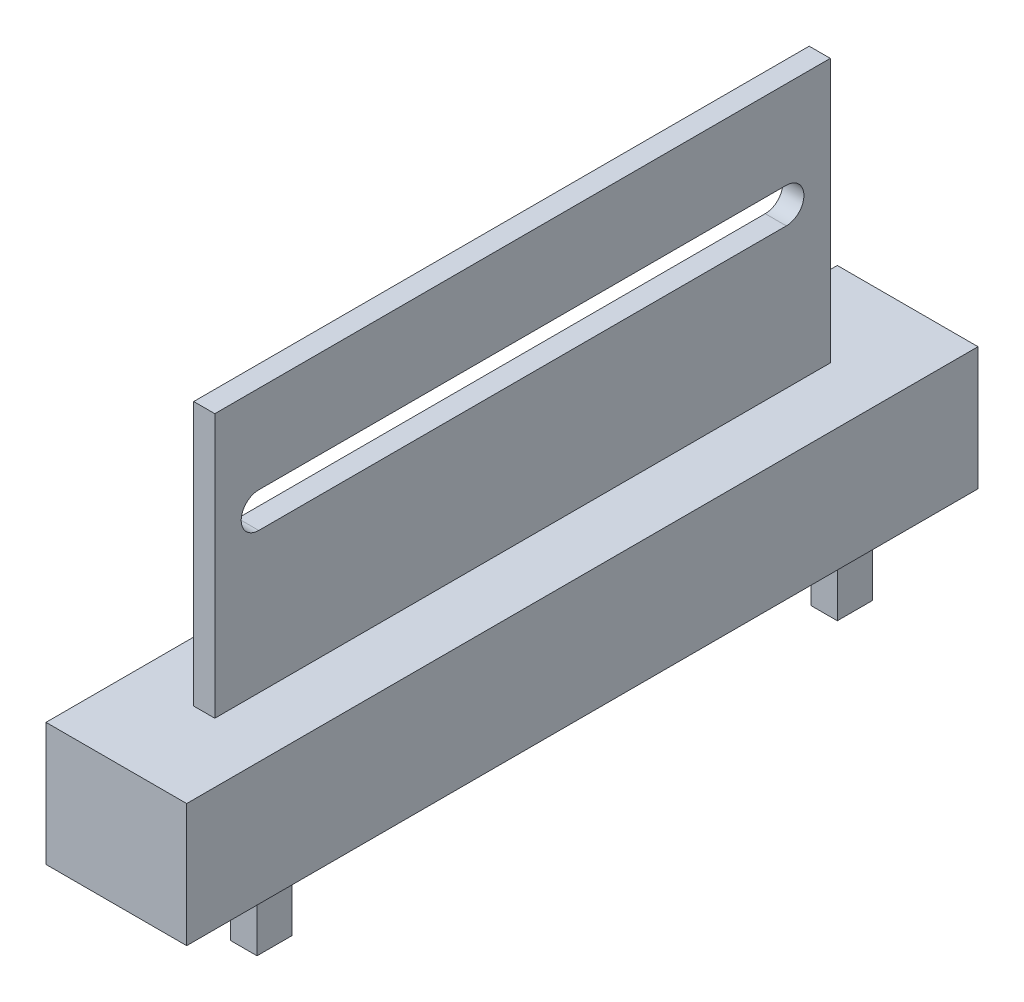
from build123d import *

# Parameters (mm, degrees)
SKETCH1_W             = 45
SKETCH1_H             = 7
BOSS_EXTRUDE1_DEPTH   = 4
SKETCH2_W             = 1.2
SKETCH2_H             = 35
BOSS_EXTRUDE2_DEPTH   = 15
SKETCH3_W             = 1.5
SKETCH3_H             = 2
BOSS_EXTRUDE3_DEPTH   = 3.5
BOSS_EXTRUDE3_2_DEPTH = 3.5
BOSS_EXTRUDE3_3_DEPTH = 3.5
BOSS_EXTRUDE3_4_DEPTH = 3.5
CUT_EXTRUDE1_DEPTH    = 10


with BuildPart() as part:
    # Sketch1 → Boss-Extrude1 (new, symmetric)
    with BuildSketch(Plane(origin=(0, 0, 0), x_dir=(0, 0, -1), z_dir=(1, 0, 0))):
        with Locations((22.5, 3.5)):
            Rectangle(SKETCH1_W, SKETCH1_H)
    extrude(amount=BOSS_EXTRUDE1_DEPTH, both=True)


with BuildPart() as body_2:
    # Sketch2 → Boss-Extrude2 (new body)
    with BuildSketch(Plane(origin=(0, 7, 0), x_dir=(1, 0, 0), z_dir=(0, 1, 0))):
        with Locations((0, 22.5)):
            Rectangle(SKETCH2_W, SKETCH2_H)
    extrude(amount=BOSS_EXTRUDE2_DEPTH)

    # Sketch4 → Cut-Extrude1 (cut)
    with BuildSketch(Plane(origin=(0.6, 0, 0), x_dir=(0, 0, -1), z_dir=(1, 0, 0))):
        with BuildLine():
            Line((7.5, 17), (37.5, 17))
            ThreePointArc((37.5, 17), (38.5, 16), (37.5, 15))
            Line((37.5, 15), (7.5, 15))
            ThreePointArc((7.5, 15), (6.5, 16), (7.5, 17))
        make_face()
    extrude(amount=-CUT_EXTRUDE1_DEPTH, mode=Mode.SUBTRACT)


with BuildPart() as body_3:
    # Sketch3 → Boss-Extrude3 (new body)
    with BuildSketch(Plane.XZ):
        with Locations((-2.25, -6)):
            Rectangle(SKETCH3_W, SKETCH3_H)
    extrude(amount=BOSS_EXTRUDE3_DEPTH)


with BuildPart() as body_4:
    # Sketch3 → Boss-Extrude3 2 (new body)
    with BuildSketch(Plane.XZ):
        with Locations((2.25, -6)):
            Rectangle(SKETCH3_W, SKETCH3_H)
    extrude(amount=BOSS_EXTRUDE3_2_DEPTH)


with BuildPart() as body_5:
    # Sketch3 → Boss-Extrude3 3 (new body)
    with BuildSketch(Plane.XZ):
        with Locations((2.25, -39)):
            Rectangle(SKETCH3_W, SKETCH3_H)
    extrude(amount=BOSS_EXTRUDE3_3_DEPTH)


with BuildPart() as body_6:
    # Sketch3 → Boss-Extrude3 4 (new body)
    with BuildSketch(Plane.XZ):
        with Locations((-2.25, -39)):
            Rectangle(SKETCH3_W, SKETCH3_H)
    extrude(amount=BOSS_EXTRUDE3_4_DEPTH)


solid = Compound([part.part, body_2.part, body_3.part, body_4.part, body_5.part, body_6.part])
